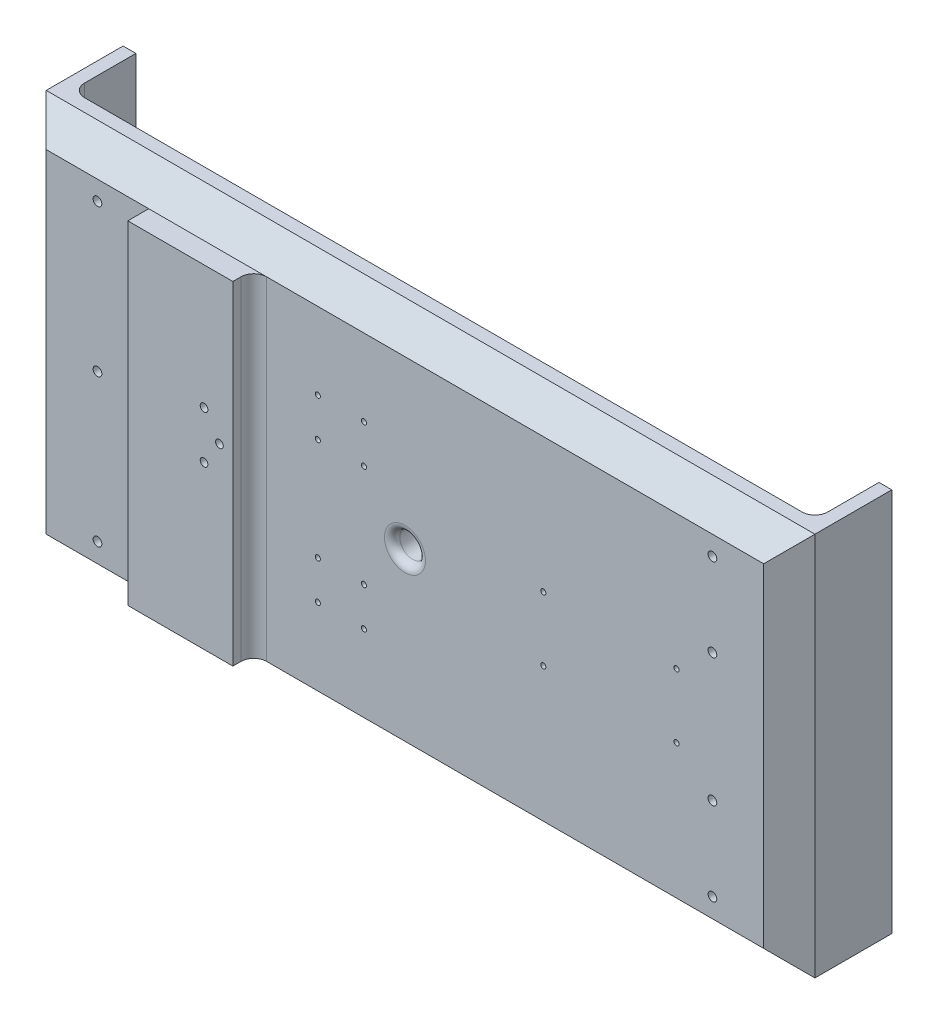
from build123d import *

# Parameters (mm, degrees)
SKETCH1_W                                       = 300
SKETCH1_H                                       = 150
BOSS_EXTRUDE1_DEPTH                             = 15
CHAMFER1_SIZE                                   = 10
CSK_FOR_M3_FLAT_HEAD_MACHINE_SCREW1_D           = 3.4
CSK_FOR_M3_FLAT_HEAD_MACHINE_SCREW1_CSINK_D     = 6.3
CSK_FOR_M3_FLAT_HEAD_MACHINE_SCREW1_CSINK_ANGLE = 90
F_3_0MM_DOWEL_HOLE1_D                           = 3
F_3_0MM_DOWEL_HOLE1_DEPTH                       = 5
F_3_0MM_DOWEL_HOLE1_TIP                         = 0.901290929
CSK_FOR_M3_FLAT_HEAD_MACHINE_SCREW2_D           = 3.4
CSK_FOR_M3_FLAT_HEAD_MACHINE_SCREW2_CSINK_D     = 6.3
CSK_FOR_M3_FLAT_HEAD_MACHINE_SCREW2_CSINK_ANGLE = 90
SKETCH9_W                                       = 41
SKETCH9_H                                       = 130
BOSS_EXTRUDE2_DEPTH                             = 8.17
FILLET1_R                                       = 5
F_3_0MM_DOWEL_HOLE2_D                           = 3
F_3_0MM_DOWEL_HOLE2_DEPTH                       = 5
F_3_0MM_DOWEL_HOLE2_TIP                         = 0.901290929
SKETCH12_W                                      = 5
SKETCH12_H                                      = 150
BOSS_EXTRUDE3_DEPTH                             = 25
FILLET2_R                                       = 5
F_2_0MM_DOWEL_HOLE1_D                           = 2
F_2_0MM_DOWEL_HOLE1_DEPTH                       = 3
F_2_0MM_DOWEL_HOLE1_TIP                         = 0.600860619
SKETCH15_R                                      = 5
CUT_EXTRUDE1_DEPTH                              = 216.870331449
FILLET3_R                                       = 3


with BuildPart() as part:
    # Sketch1 → Boss-Extrude1 (new body)
    with BuildSketch(Plane.XY):
        with Locations((0, 75)):
            Rectangle(SKETCH1_W, SKETCH1_H)
    extrude(amount=BOSS_EXTRUDE1_DEPTH)

    # Chamfer1
    chamfer1_edges = [part.edges().sort_by_distance(p)[0] for p in [
        (-150, 75, 15),
        (0, 0, 15),
        (150, 75, 15),
        (0, 150, 15),
    ]]
    chamfer(chamfer1_edges, length=CHAMFER1_SIZE)

    # CSK for M3 Flat Head Machine Screw1 (through all)
    with Locations(Plane(origin=(0, 0, 0), x_dir=(-1, 0, 0), z_dir=(0, 0, -1))):
        with Locations((-120, 132.5), (-120, 17.5), (120, 17.5), (120, 132.5)):
            CounterSinkHole(CSK_FOR_M3_FLAT_HEAD_MACHINE_SCREW1_D / 2, CSK_FOR_M3_FLAT_HEAD_MACHINE_SCREW1_CSINK_D / 2, counter_sink_angle=CSK_FOR_M3_FLAT_HEAD_MACHINE_SCREW1_CSINK_ANGLE)

    # Ø3.0mm Dowel Hole1
    with Locations(Plane(origin=(0, 0, 0), x_dir=(-1, 0, 0), z_dir=(0, 0, -1))):
        with Locations((-108, 120), (-89.5, 120), (-98.75, 114), (-98.75, 17.4), (-108, 11.4), (-89.5, 11.4), (89.5, 30), (108, 30), (98.75, 36), (89.5, 138.6), (108, 138.6), (98.75, 132.6)):
            Hole(F_3_0MM_DOWEL_HOLE1_D / 2, depth=F_3_0MM_DOWEL_HOLE1_DEPTH)
            with Locations((0, 0, -(F_3_0MM_DOWEL_HOLE1_DEPTH + F_3_0MM_DOWEL_HOLE1_TIP / 2))):  # 118° drill point
                Cone(0, F_3_0MM_DOWEL_HOLE1_D / 2, F_3_0MM_DOWEL_HOLE1_TIP, mode=Mode.SUBTRACT)

    # CSK for M3 Flat Head Machine Screw2 (through all)
    with Locations(Plane(origin=(0, 0, 0), x_dir=(-1, 0, 0), z_dir=(0, 0, -1))):
        with Locations((120, 75), (-120, 50), (-120, 100)):
            CounterSinkHole(CSK_FOR_M3_FLAT_HEAD_MACHINE_SCREW2_D / 2, CSK_FOR_M3_FLAT_HEAD_MACHINE_SCREW2_CSINK_D / 2, counter_sink_angle=CSK_FOR_M3_FLAT_HEAD_MACHINE_SCREW2_CSINK_ANGLE)

    # Sketch9 → Boss-Extrude2 (add)
    with BuildSketch(Plane.XY.offset(15)):
        with Locations((-79.5, 75)):
            Rectangle(SKETCH9_W, SKETCH9_H)
    extrude(amount=BOSS_EXTRUDE2_DEPTH)

    # Fillet1
    fillet1_edges = [part.edges().sort_by_distance(p)[0] for p in [
        (-59, 75, 15),
    ]]
    fillet(fillet1_edges, radius=FILLET1_R)

    # Ø3.0mm Dowel Hole2
    with Locations(Plane.XY.offset(23.17)):
        with Locations((-70.23, 91.75), (-70.23, 73.25), (-64.23, 82.5)):
            Hole(F_3_0MM_DOWEL_HOLE2_D / 2, depth=F_3_0MM_DOWEL_HOLE2_DEPTH)
            with Locations((0, 0, -(F_3_0MM_DOWEL_HOLE2_DEPTH + F_3_0MM_DOWEL_HOLE2_TIP / 2))):  # 118° drill point
                Cone(0, F_3_0MM_DOWEL_HOLE2_D / 2, F_3_0MM_DOWEL_HOLE2_TIP, mode=Mode.SUBTRACT)

    # Sketch12 → Boss-Extrude3 (add)
    with BuildSketch(Plane(origin=(0, 0, 0), x_dir=(-1, 0, 0), z_dir=(0, 0, -1))):
        with Locations((-147.5, 75)):
            Rectangle(SKETCH12_W, SKETCH12_H)
        with Locations((147.5, 75)):
            Rectangle(SKETCH12_W, SKETCH12_H)
    extrude(amount=BOSS_EXTRUDE3_DEPTH)

    # Fillet2
    fillet2_edges = [part.edges().sort_by_distance(p)[0] for p in [
        (145, 75, 0),
        (-145, 75, 0),
    ]]
    fillet(fillet2_edges, radius=FILLET2_R)

    # Ø2.0mm Dowel Hole1
    with Locations(Plane.XY.offset(15)):
        with Locations((-34, 110), (-16, 110), (-16, 95), (-34, 95), (-34, 55), (-16, 55), (-16, 40), (-34, 40), (54, 87.5), (106, 87.5), (106, 62.5), (54, 62.5)):
            Hole(F_2_0MM_DOWEL_HOLE1_D / 2, depth=F_2_0MM_DOWEL_HOLE1_DEPTH)
            with Locations((0, 0, -(F_2_0MM_DOWEL_HOLE1_DEPTH + F_2_0MM_DOWEL_HOLE1_TIP / 2))):  # 118° drill point
                Cone(0, F_2_0MM_DOWEL_HOLE1_D / 2, F_2_0MM_DOWEL_HOLE1_TIP, mode=Mode.SUBTRACT)

    # Sketch15 → Cut-Extrude1 (cut, through all)
    with BuildSketch(Plane.XY.offset(15)):
        with Locations((0, 75)):
            Circle(SKETCH15_R)
    extrude(amount=-CUT_EXTRUDE1_DEPTH, mode=Mode.SUBTRACT)

    # Fillet3
    fillet3_edges = [part.edges().sort_by_distance(p)[0] for p in [
        (-5, 75, 0),
        (-5, 75, 15),
    ]]
    fillet(fillet3_edges, radius=FILLET3_R)


solid = part.part
